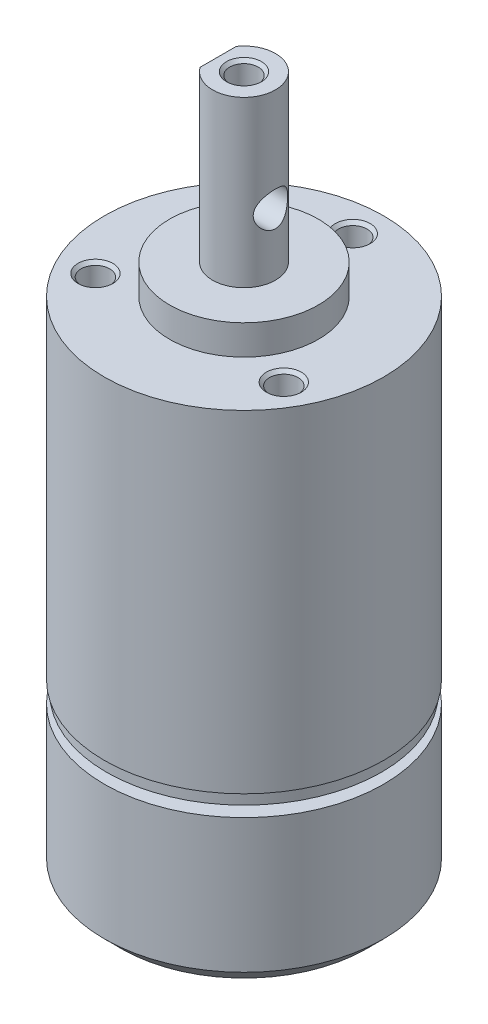
from build123d import *

# Parameters (mm, degrees)
SKETCH_2_R                   = 2.75
EXTRUDE_1_DEPTH              = 14.4
CUT_EXTRUDE_1_DEPTH          = 51.066755437
CUT_EXTRUDE_1_DEPTH_BACK     = 51.066755437
SKETCH_3_W                   = 1.5
SKETCH_3_H                   = 12
CUT_EXTRUDE_2_REACH          = 52.662
CUT_EXTRUDE_2_END_RADIUS     = 2.75
SKETCH_4_R                   = 1.5
HOLE_WIZARD_M3_1_D           = 2.5
HOLE_WIZARD_M3_1_DEPTH       = 5.5
HOLE_WIZARD_M3_1_CSINK_D     = 3.05
HOLE_WIZARD_M3_1_CSINK_ANGLE = 90
HOLE_WIZARD_M3_1_TIP         = 0.751075774
HOLE_WIZARD_M3_2_D           = 2.5
HOLE_WIZARD_M3_2_DEPTH       = 4
HOLE_WIZARD_M3_2_CSINK_D     = 3.05
HOLE_WIZARD_M3_2_CSINK_ANGLE = 90
HOLE_WIZARD_M3_2_TIP         = 0.751075774
CHAMFER_1_SIZE               = 1.5
SKETCH_9_R                   = 3
EXTRUDE_2_DEPTH              = 4


with BuildPart() as part:
    # 草图1 → 旋转1 (revolve)
    with BuildSketch(Plane.XY, mode=Mode.PRIVATE) as revolve_1_sk:
        Polygon((3, 0), (12, 0), (12, 1), (12.2, 1), (12.2, 30), (6.5, 30), (6.5, 32.6), (0, 32.6), (0, -14), (12.2, -14), (12.2, -0.8), (3, -0.8), align=None)
    revolve(revolve_1_sk.sketch.rotate(Axis((0, 32.6, 0), (0, -1, 0)), 180), axis=Axis((0, 32.6, 0), (0, -1, 0)))

    # 草图2 → 凸台-拉伸1 (add)
    with BuildSketch(Plane(origin=(0, 32.6, 0), x_dir=(1, 0, 0), z_dir=(0, 1, 0))):
        Circle(SKETCH_2_R)
    extrude(amount=EXTRUDE_1_DEPTH)

    # 草图3 → 切除-拉伸1 (cut, two sides: drawn at the far end of the back side and taken through both)
    with BuildSketch(Plane.XY.offset(-CUT_EXTRUDE_1_DEPTH_BACK)):
        with Locations((-3, 41.5)):
            Rectangle(SKETCH_3_W, SKETCH_3_H)
    extrude(amount=CUT_EXTRUDE_1_DEPTH + CUT_EXTRUDE_1_DEPTH_BACK, mode=Mode.SUBTRACT)

    # 切除-拉伸2: up to this cylinder (the profile starts inside it)
    cut_extrude_2_end = Plane(origin=(0, 38, 0), z_dir=(0, -1, 0)) * Cylinder(CUT_EXTRUDE_2_END_RADIUS, 111.824, mode=Mode.PRIVATE)
    # 草图4 → 切除-拉伸2 (cut, up to the surface)
    with BuildSketch(Plane.ZY.offset(2.25), mode=Mode.PRIVATE) as cut_extrude_2_sk1:
        with Locations(Location((0, 38, 0), (0, 0, 270))):
            Circle(SKETCH_4_R)
    cut_extrude_2_tool1 = extrude(cut_extrude_2_sk1.sketch, amount=-CUT_EXTRUDE_2_REACH, mode=Mode.PRIVATE) & cut_extrude_2_end
    add(cut_extrude_2_tool1.solids().sort_by_distance((-2.25, 38, 0))[0], mode=Mode.SUBTRACT)

    # M3 螺纹孔1
    with Locations(Plane(origin=(0, 47, 0), x_dir=(1, 0, 0), z_dir=(0, 1, 0))):
        with Locations((0, 0)):
            CounterSinkHole(HOLE_WIZARD_M3_1_D / 2, HOLE_WIZARD_M3_1_CSINK_D / 2, depth=HOLE_WIZARD_M3_1_DEPTH, counter_sink_angle=HOLE_WIZARD_M3_1_CSINK_ANGLE)
            with Locations((0, 0, -(HOLE_WIZARD_M3_1_DEPTH + HOLE_WIZARD_M3_1_TIP / 2))):  # 118° drill point
                Cone(0, HOLE_WIZARD_M3_1_D / 2, HOLE_WIZARD_M3_1_TIP, mode=Mode.SUBTRACT)

    # M3 螺纹孔2
    with Locations(Plane(origin=(8.227241336, 30, 4.75), x_dir=(1, 0, 0), z_dir=(0, 1, 0))):
        with Locations((0, 0), (-16.454482672, 0), (-8.227241336, 14.25)):
            CounterSinkHole(HOLE_WIZARD_M3_2_D / 2, HOLE_WIZARD_M3_2_CSINK_D / 2, depth=HOLE_WIZARD_M3_2_DEPTH, counter_sink_angle=HOLE_WIZARD_M3_2_CSINK_ANGLE)
            with Locations((0, 0, -(HOLE_WIZARD_M3_2_DEPTH + HOLE_WIZARD_M3_2_TIP / 2))):  # 118° drill point
                Cone(0, HOLE_WIZARD_M3_2_D / 2, HOLE_WIZARD_M3_2_TIP, mode=Mode.SUBTRACT)

    # 倒角1
    chamfer_1_edges = [part.edges().sort_by_distance(p)[0] for p in [
        (12.2, -14, 0),
    ]]
    chamfer(chamfer_1_edges, length=CHAMFER_1_SIZE)

    # 草图9 → 凸台-拉伸2 (add)
    with BuildSketch(Plane.XZ.offset(14)):
        with Locations(Location((0, 0, 0), (0, 0, 180))):
            Circle(SKETCH_9_R)
    extrude(amount=EXTRUDE_2_DEPTH)


solid = part.part
